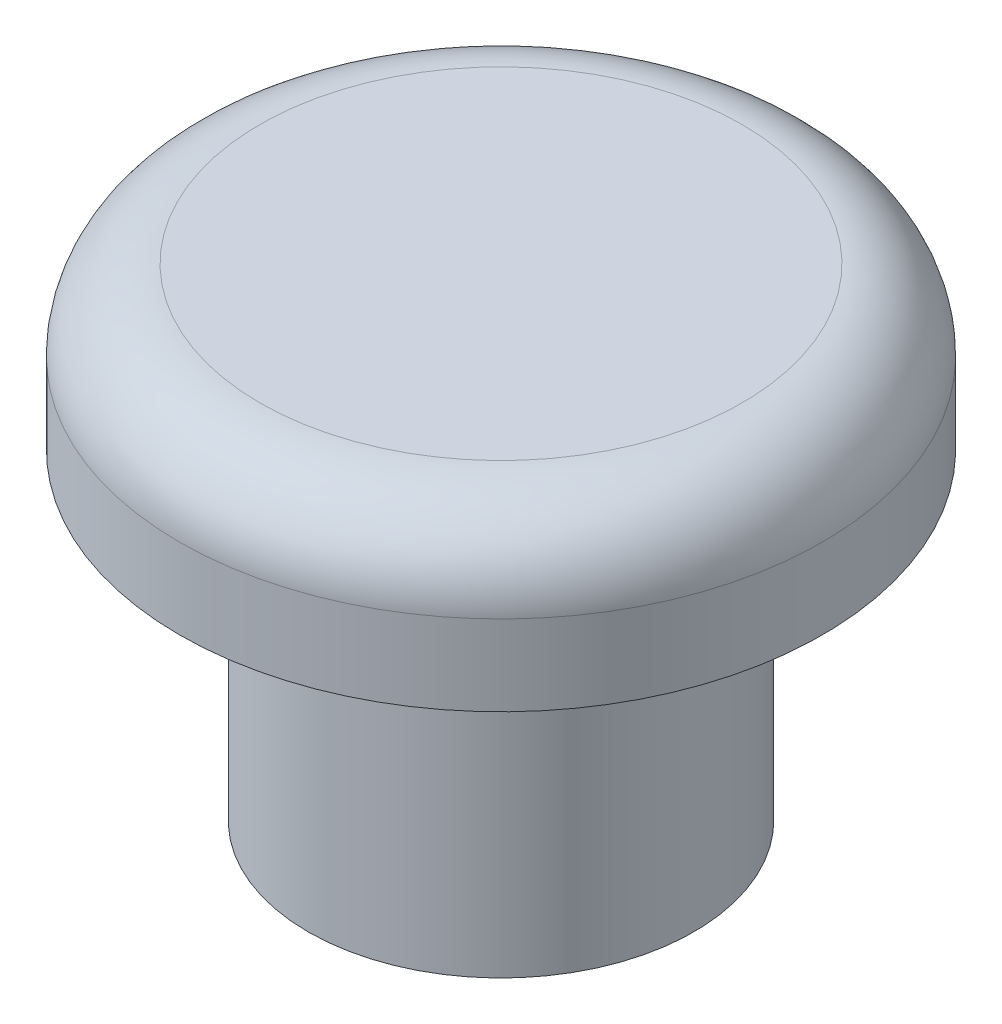
from build123d import *

# Parameters (mm, degrees)
SKETCH1_R           = 6
SKETCH1_R_2         = 4.075
BOSS_EXTRUDE1_DEPTH = 10
SKETCH2_R           = 10
BOSS_EXTRUDE2_DEPTH = 5
FILLET1_R           = 2.5


with BuildPart() as part:
    # Sketch1 → Boss-Extrude1 (new body)
    with BuildSketch(Plane(origin=(0, 0, 0), x_dir=(1, 0, 0), z_dir=(0, 1, 0))):
        with Locations(Location((0, 0, 0), (0, 0, 270))):
            Circle(SKETCH1_R)
        with Locations(Location((0, 0, 0), (0, 0, 270))):
            Circle(SKETCH1_R_2, mode=Mode.SUBTRACT)
    extrude(amount=BOSS_EXTRUDE1_DEPTH)

    # Sketch2 → Boss-Extrude2 (add)
    with BuildSketch(Plane(origin=(0, 10, 0), x_dir=(1, 0, 0), z_dir=(0, 1, 0))):
        with Locations(Location((0, 0, 0), (0, 0, 270))):
            Circle(SKETCH2_R)
    extrude(amount=BOSS_EXTRUDE2_DEPTH)

    # Fillet1
    fillet1_edges = [part.edges().sort_by_distance(p)[0] for p in [
        (0, 15, -10),
    ]]
    fillet(fillet1_edges, radius=FILLET1_R)


solid = part.part
